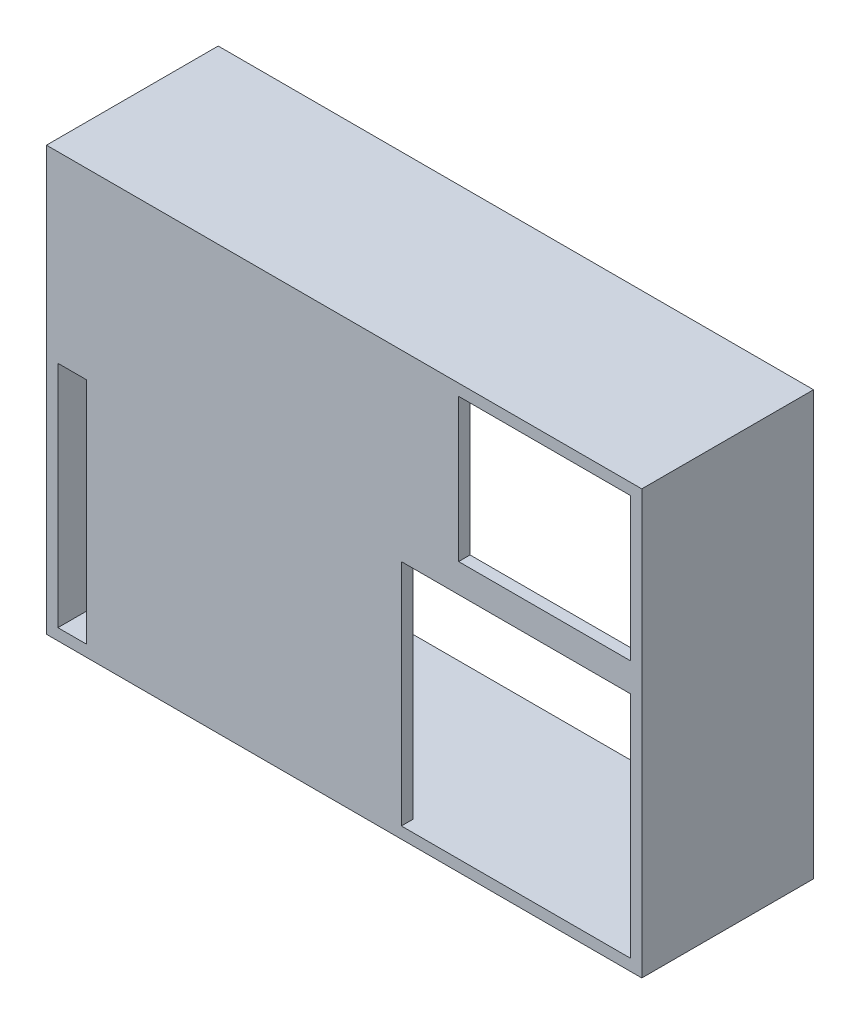
from build123d import *

# Parameters (mm, degrees)
SKETCH1_W           = 104
SKETCH1_H           = 74
SKETCH1_W_2         = 5
SKETCH1_H_2         = 40
SKETCH1_W_3         = 40
SKETCH1_W_4         = 30
SKETCH1_H_3         = 25
BOSS_EXTRUDE1_DEPTH = 30
SKETCH2_W           = 100
SKETCH2_H           = 70
CUT_EXTRUDE1_DEPTH  = 28


with BuildPart() as part:
    # Sketch1 → Boss-Extrude1 (new body)
    with BuildSketch(Plane.XY):
        with Locations((-52, 37)):
            Rectangle(SKETCH1_W, SKETCH1_H)
        with Locations((-99.5, 22)):
            Rectangle(SKETCH1_W_2, SKETCH1_H_2, mode=Mode.SUBTRACT)
        with Locations((-22, 22)):
            Rectangle(SKETCH1_W_3, SKETCH1_H_2, mode=Mode.SUBTRACT)
        with Locations((-17, 59.5)):
            Rectangle(SKETCH1_W_4, SKETCH1_H_3, mode=Mode.SUBTRACT)
    extrude(amount=BOSS_EXTRUDE1_DEPTH)

    # Sketch2 → Cut-Extrude1 (cut)
    with BuildSketch(Plane(origin=(0, 0, 0), x_dir=(-1, 0, 0), z_dir=(0, 0, -1))):
        with Locations((52, 37)):
            Rectangle(SKETCH2_W, SKETCH2_H)
    extrude(amount=-CUT_EXTRUDE1_DEPTH, mode=Mode.SUBTRACT)


solid = part.part
